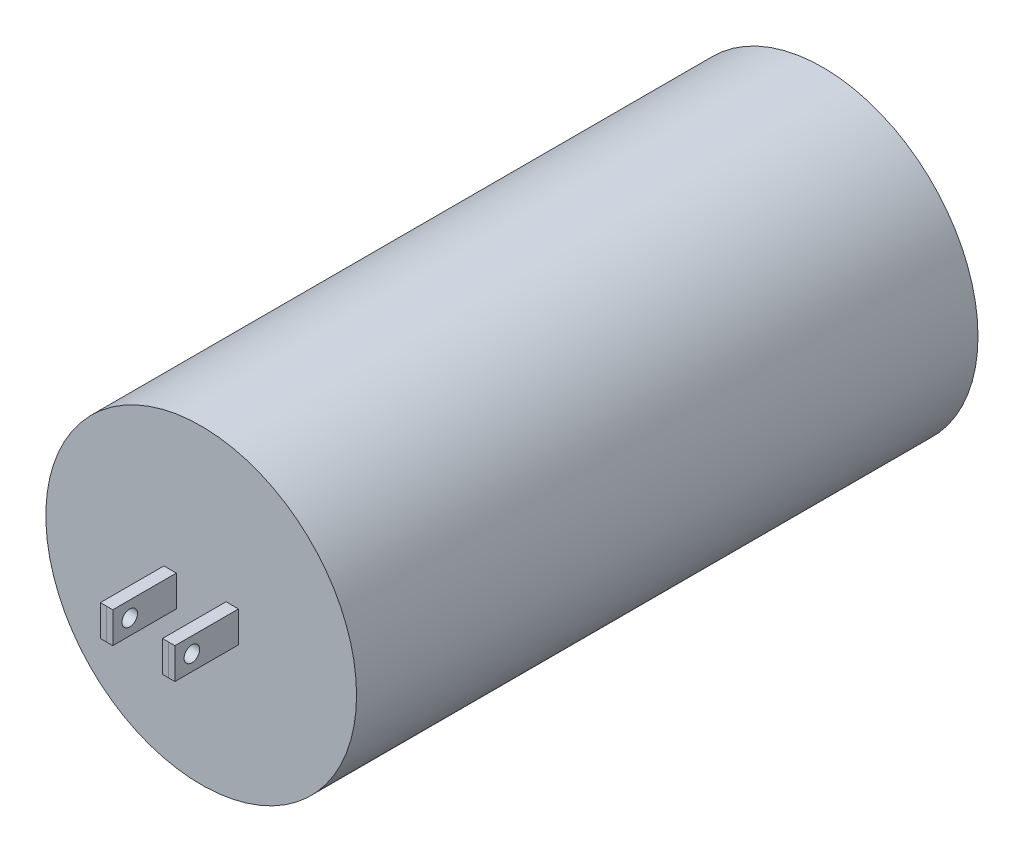
from build123d import *

# Parameters (mm, degrees)
SKETCH1_R           = 50
BOSS_EXTRUDE1_DEPTH = 200
SKETCH2_W           = 2
SKETCH2_H           = 20.463168159
BOSS_EXTRUDE2_DEPTH = 5
SKETCH3_R           = 2.5
CUT_EXTRUDE1_DEPTH  = 17
BOSS_EXTRUDE3_START = 200
SKETCH4_W           = 2
SKETCH4_H           = 10
BOSS_EXTRUDE3_DEPTH = 20.46
SKETCH5_R           = 2.5
CUT_EXTRUDE2_DEPTH  = 12.5


with BuildPart() as part:
    # Sketch1 → Boss-Extrude1 (new body)
    with BuildSketch(Plane.XY):
        Circle(SKETCH1_R)
    extrude(amount=BOSS_EXTRUDE1_DEPTH)

    # Sketch2 → Boss-Extrude2 (add, symmetric)
    with BuildSketch(Plane(origin=(0, 0, 0), x_dir=(1, 0, 0), z_dir=(0, 1, 0))):
        with Locations((-11, -210.23158408)):
            Rectangle(SKETCH2_W, SKETCH2_H)
        with Locations((11, -210.23158408)):
            Rectangle(SKETCH2_W, SKETCH2_H)
    extrude(amount=BOSS_EXTRUDE2_DEPTH, both=True)

    # Sketch3 → Cut-Extrude1 (cut, symmetric)
    with BuildSketch(Plane(origin=(0, 0, 0), x_dir=(0, 0, -1), z_dir=(1, 0, 0))):
        with Locations((-215, 0)):
            Circle(SKETCH3_R)
    extrude(amount=CUT_EXTRUDE1_DEPTH, both=True, mode=Mode.SUBTRACT)

    # Sketch4 → Boss-Extrude3 (add)
    with BuildSketch(Plane.XY.offset(BOSS_EXTRUDE3_START)):
        with Locations((-9, 0)):
            Rectangle(SKETCH4_W, SKETCH4_H)
        with Locations((9, 0)):
            Rectangle(SKETCH4_W, SKETCH4_H)
    extrude(amount=BOSS_EXTRUDE3_DEPTH)

    # Sketch5 → Cut-Extrude2 (cut, symmetric)
    with BuildSketch(Plane(origin=(0, 0, 0), x_dir=(0, 0, -1), z_dir=(1, 0, 0))):
        with Locations((-215, 0)):
            Circle(SKETCH5_R)
    extrude(amount=CUT_EXTRUDE2_DEPTH, both=True, mode=Mode.SUBTRACT)


solid = part.part
